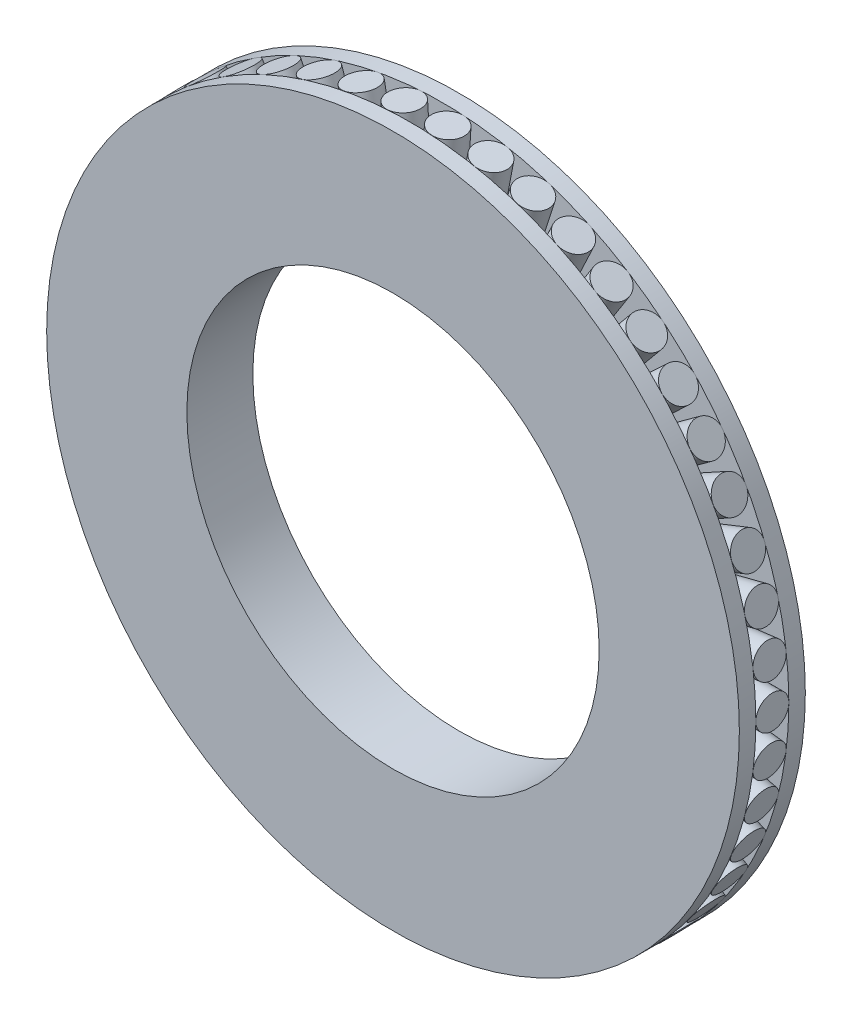
from build123d import *

# Parameters (mm, degrees)
SKETCH_1_R               = 21
SKETCH_1_R_2             = 12.5
EXTRUDE_1_DEPTH          = 4
CUT_EXTRUDE_1_DEPTH      = 1
CUT_EXTRUDE_1_DEPTH_BACK = 1
SKETCH_2_R               = 21
SKETCH_2_R_2             = 15
EXTRUDE_2_DEPTH          = 4
EXTRUDE_2_DEPTH_BACK     = 1
SKETCH_3_R               = 1
PATTERN_CIRCULAR_1_COUNT = 50


with BuildPart() as part:
    # 草图1 → 凸台-拉伸1 (new body)
    with BuildSketch(Plane.XY):
        Circle(SKETCH_1_R)
        Circle(SKETCH_1_R_2, mode=Mode.SUBTRACT)
    extrude(amount=EXTRUDE_1_DEPTH)

    # 草图2 → 切除-拉伸1 (cut, two sides: drawn at the far end of the back side and taken through both)
    with BuildSketch(Plane(origin=(0, 0, 2), x_dir=(-1, 0, 0), z_dir=(0, 0, -1)).offset(-CUT_EXTRUDE_1_DEPTH_BACK)):
        Circle(SKETCH_2_R)
        Circle(SKETCH_2_R_2, mode=Mode.SUBTRACT)
    extrude(amount=CUT_EXTRUDE_1_DEPTH + CUT_EXTRUDE_1_DEPTH_BACK, mode=Mode.SUBTRACT)


with BuildPart() as body_2:
    # 草图3 → 凸台-拉伸2 (new, two sides: drawn at the far end of the back side and taken through both)
    with BuildSketch(Plane(origin=(17, 0, 0), x_dir=(0, 0, -1), z_dir=(1, 0, 0)).offset(-EXTRUDE_2_DEPTH_BACK)):
        with Locations((-2, 0)):
            Circle(SKETCH_3_R)
    extrude(amount=EXTRUDE_2_DEPTH + EXTRUDE_2_DEPTH_BACK)


with BuildPart() as pattern_circular_1_1:
    # 阵列(圆周)1: pattern copy
    add(body_2.part.rotate(Axis((0, 0, 4), (0, 0, -1)), 1 * 360 / PATTERN_CIRCULAR_1_COUNT))


with BuildPart() as pattern_circular_1_2:
    # 阵列(圆周)1: pattern copy
    add(body_2.part.rotate(Axis((0, 0, 4), (0, 0, -1)), 2 * 360 / PATTERN_CIRCULAR_1_COUNT))


with BuildPart() as pattern_circular_1_3:
    # 阵列(圆周)1: pattern copy
    add(body_2.part.rotate(Axis((0, 0, 4), (0, 0, -1)), 3 * 360 / PATTERN_CIRCULAR_1_COUNT))


with BuildPart() as pattern_circular_1_4:
    # 阵列(圆周)1: pattern copy
    add(body_2.part.rotate(Axis((0, 0, 4), (0, 0, -1)), 4 * 360 / PATTERN_CIRCULAR_1_COUNT))


with BuildPart() as pattern_circular_1_5:
    # 阵列(圆周)1: pattern copy
    add(body_2.part.rotate(Axis((0, 0, 4), (0, 0, -1)), 5 * 360 / PATTERN_CIRCULAR_1_COUNT))


with BuildPart() as pattern_circular_1_6:
    # 阵列(圆周)1: pattern copy
    add(body_2.part.rotate(Axis((0, 0, 4), (0, 0, -1)), 6 * 360 / PATTERN_CIRCULAR_1_COUNT))


with BuildPart() as pattern_circular_1_7:
    # 阵列(圆周)1: pattern copy
    add(body_2.part.rotate(Axis((0, 0, 4), (0, 0, -1)), 7 * 360 / PATTERN_CIRCULAR_1_COUNT))


with BuildPart() as pattern_circular_1_8:
    # 阵列(圆周)1: pattern copy
    add(body_2.part.rotate(Axis((0, 0, 4), (0, 0, -1)), 8 * 360 / PATTERN_CIRCULAR_1_COUNT))


with BuildPart() as pattern_circular_1_9:
    # 阵列(圆周)1: pattern copy
    add(body_2.part.rotate(Axis((0, 0, 4), (0, 0, -1)), 9 * 360 / PATTERN_CIRCULAR_1_COUNT))


with BuildPart() as pattern_circular_1_10:
    # 阵列(圆周)1: pattern copy
    add(body_2.part.rotate(Axis((0, 0, 4), (0, 0, -1)), 10 * 360 / PATTERN_CIRCULAR_1_COUNT))


with BuildPart() as pattern_circular_1_11:
    # 阵列(圆周)1: pattern copy
    add(body_2.part.rotate(Axis((0, 0, 4), (0, 0, -1)), 11 * 360 / PATTERN_CIRCULAR_1_COUNT))


with BuildPart() as pattern_circular_1_12:
    # 阵列(圆周)1: pattern copy
    add(body_2.part.rotate(Axis((0, 0, 4), (0, 0, -1)), 12 * 360 / PATTERN_CIRCULAR_1_COUNT))


with BuildPart() as pattern_circular_1_13:
    # 阵列(圆周)1: pattern copy
    add(body_2.part.rotate(Axis((0, 0, 4), (0, 0, -1)), 13 * 360 / PATTERN_CIRCULAR_1_COUNT))


with BuildPart() as pattern_circular_1_14:
    # 阵列(圆周)1: pattern copy
    add(body_2.part.rotate(Axis((0, 0, 4), (0, 0, -1)), 14 * 360 / PATTERN_CIRCULAR_1_COUNT))


with BuildPart() as pattern_circular_1_15:
    # 阵列(圆周)1: pattern copy
    add(body_2.part.rotate(Axis((0, 0, 4), (0, 0, -1)), 15 * 360 / PATTERN_CIRCULAR_1_COUNT))


with BuildPart() as pattern_circular_1_16:
    # 阵列(圆周)1: pattern copy
    add(body_2.part.rotate(Axis((0, 0, 4), (0, 0, -1)), 16 * 360 / PATTERN_CIRCULAR_1_COUNT))


with BuildPart() as pattern_circular_1_17:
    # 阵列(圆周)1: pattern copy
    add(body_2.part.rotate(Axis((0, 0, 4), (0, 0, -1)), 17 * 360 / PATTERN_CIRCULAR_1_COUNT))


with BuildPart() as pattern_circular_1_18:
    # 阵列(圆周)1: pattern copy
    add(body_2.part.rotate(Axis((0, 0, 4), (0, 0, -1)), 18 * 360 / PATTERN_CIRCULAR_1_COUNT))


with BuildPart() as pattern_circular_1_19:
    # 阵列(圆周)1: pattern copy
    add(body_2.part.rotate(Axis((0, 0, 4), (0, 0, -1)), 19 * 360 / PATTERN_CIRCULAR_1_COUNT))


with BuildPart() as pattern_circular_1_20:
    # 阵列(圆周)1: pattern copy
    add(body_2.part.rotate(Axis((0, 0, 4), (0, 0, -1)), 20 * 360 / PATTERN_CIRCULAR_1_COUNT))


with BuildPart() as pattern_circular_1_21:
    # 阵列(圆周)1: pattern copy
    add(body_2.part.rotate(Axis((0, 0, 4), (0, 0, -1)), 21 * 360 / PATTERN_CIRCULAR_1_COUNT))


with BuildPart() as pattern_circular_1_22:
    # 阵列(圆周)1: pattern copy
    add(body_2.part.rotate(Axis((0, 0, 4), (0, 0, -1)), 22 * 360 / PATTERN_CIRCULAR_1_COUNT))


with BuildPart() as pattern_circular_1_23:
    # 阵列(圆周)1: pattern copy
    add(body_2.part.rotate(Axis((0, 0, 4), (0, 0, -1)), 23 * 360 / PATTERN_CIRCULAR_1_COUNT))


with BuildPart() as pattern_circular_1_24:
    # 阵列(圆周)1: pattern copy
    add(body_2.part.rotate(Axis((0, 0, 4), (0, 0, -1)), 24 * 360 / PATTERN_CIRCULAR_1_COUNT))


with BuildPart() as pattern_circular_1_25:
    # 阵列(圆周)1: pattern copy
    add(body_2.part.rotate(Axis((0, 0, 4), (0, 0, -1)), 25 * 360 / PATTERN_CIRCULAR_1_COUNT))


with BuildPart() as pattern_circular_1_26:
    # 阵列(圆周)1: pattern copy
    add(body_2.part.rotate(Axis((0, 0, 4), (0, 0, -1)), 26 * 360 / PATTERN_CIRCULAR_1_COUNT))


with BuildPart() as pattern_circular_1_27:
    # 阵列(圆周)1: pattern copy
    add(body_2.part.rotate(Axis((0, 0, 4), (0, 0, -1)), 27 * 360 / PATTERN_CIRCULAR_1_COUNT))


with BuildPart() as pattern_circular_1_28:
    # 阵列(圆周)1: pattern copy
    add(body_2.part.rotate(Axis((0, 0, 4), (0, 0, -1)), 28 * 360 / PATTERN_CIRCULAR_1_COUNT))


with BuildPart() as pattern_circular_1_29:
    # 阵列(圆周)1: pattern copy
    add(body_2.part.rotate(Axis((0, 0, 4), (0, 0, -1)), 29 * 360 / PATTERN_CIRCULAR_1_COUNT))


with BuildPart() as pattern_circular_1_30:
    # 阵列(圆周)1: pattern copy
    add(body_2.part.rotate(Axis((0, 0, 4), (0, 0, -1)), 30 * 360 / PATTERN_CIRCULAR_1_COUNT))


with BuildPart() as pattern_circular_1_31:
    # 阵列(圆周)1: pattern copy
    add(body_2.part.rotate(Axis((0, 0, 4), (0, 0, -1)), 31 * 360 / PATTERN_CIRCULAR_1_COUNT))


with BuildPart() as pattern_circular_1_32:
    # 阵列(圆周)1: pattern copy
    add(body_2.part.rotate(Axis((0, 0, 4), (0, 0, -1)), 32 * 360 / PATTERN_CIRCULAR_1_COUNT))


with BuildPart() as pattern_circular_1_33:
    # 阵列(圆周)1: pattern copy
    add(body_2.part.rotate(Axis((0, 0, 4), (0, 0, -1)), 33 * 360 / PATTERN_CIRCULAR_1_COUNT))


with BuildPart() as pattern_circular_1_34:
    # 阵列(圆周)1: pattern copy
    add(body_2.part.rotate(Axis((0, 0, 4), (0, 0, -1)), 34 * 360 / PATTERN_CIRCULAR_1_COUNT))


with BuildPart() as pattern_circular_1_35:
    # 阵列(圆周)1: pattern copy
    add(body_2.part.rotate(Axis((0, 0, 4), (0, 0, -1)), 35 * 360 / PATTERN_CIRCULAR_1_COUNT))


with BuildPart() as pattern_circular_1_36:
    # 阵列(圆周)1: pattern copy
    add(body_2.part.rotate(Axis((0, 0, 4), (0, 0, -1)), 36 * 360 / PATTERN_CIRCULAR_1_COUNT))


with BuildPart() as pattern_circular_1_37:
    # 阵列(圆周)1: pattern copy
    add(body_2.part.rotate(Axis((0, 0, 4), (0, 0, -1)), 37 * 360 / PATTERN_CIRCULAR_1_COUNT))


with BuildPart() as pattern_circular_1_38:
    # 阵列(圆周)1: pattern copy
    add(body_2.part.rotate(Axis((0, 0, 4), (0, 0, -1)), 38 * 360 / PATTERN_CIRCULAR_1_COUNT))


with BuildPart() as pattern_circular_1_39:
    # 阵列(圆周)1: pattern copy
    add(body_2.part.rotate(Axis((0, 0, 4), (0, 0, -1)), 39 * 360 / PATTERN_CIRCULAR_1_COUNT))


with BuildPart() as pattern_circular_1_40:
    # 阵列(圆周)1: pattern copy
    add(body_2.part.rotate(Axis((0, 0, 4), (0, 0, -1)), 40 * 360 / PATTERN_CIRCULAR_1_COUNT))


with BuildPart() as pattern_circular_1_41:
    # 阵列(圆周)1: pattern copy
    add(body_2.part.rotate(Axis((0, 0, 4), (0, 0, -1)), 41 * 360 / PATTERN_CIRCULAR_1_COUNT))


with BuildPart() as pattern_circular_1_42:
    # 阵列(圆周)1: pattern copy
    add(body_2.part.rotate(Axis((0, 0, 4), (0, 0, -1)), 42 * 360 / PATTERN_CIRCULAR_1_COUNT))


with BuildPart() as pattern_circular_1_43:
    # 阵列(圆周)1: pattern copy
    add(body_2.part.rotate(Axis((0, 0, 4), (0, 0, -1)), 43 * 360 / PATTERN_CIRCULAR_1_COUNT))


with BuildPart() as pattern_circular_1_44:
    # 阵列(圆周)1: pattern copy
    add(body_2.part.rotate(Axis((0, 0, 4), (0, 0, -1)), 44 * 360 / PATTERN_CIRCULAR_1_COUNT))


with BuildPart() as pattern_circular_1_45:
    # 阵列(圆周)1: pattern copy
    add(body_2.part.rotate(Axis((0, 0, 4), (0, 0, -1)), 45 * 360 / PATTERN_CIRCULAR_1_COUNT))


with BuildPart() as pattern_circular_1_46:
    # 阵列(圆周)1: pattern copy
    add(body_2.part.rotate(Axis((0, 0, 4), (0, 0, -1)), 46 * 360 / PATTERN_CIRCULAR_1_COUNT))


with BuildPart() as pattern_circular_1_47:
    # 阵列(圆周)1: pattern copy
    add(body_2.part.rotate(Axis((0, 0, 4), (0, 0, -1)), 47 * 360 / PATTERN_CIRCULAR_1_COUNT))


with BuildPart() as pattern_circular_1_48:
    # 阵列(圆周)1: pattern copy
    add(body_2.part.rotate(Axis((0, 0, 4), (0, 0, -1)), 48 * 360 / PATTERN_CIRCULAR_1_COUNT))


with BuildPart() as pattern_circular_1_49:
    # 阵列(圆周)1: pattern copy
    add(body_2.part.rotate(Axis((0, 0, 4), (0, 0, -1)), 49 * 360 / PATTERN_CIRCULAR_1_COUNT))


solid = Compound([part.part, body_2.part, pattern_circular_1_1.part, pattern_circular_1_2.part, pattern_circular_1_3.part, pattern_circular_1_4.part, pattern_circular_1_5.part, pattern_circular_1_6.part, pattern_circular_1_7.part, pattern_circular_1_8.part, pattern_circular_1_9.part, pattern_circular_1_10.part, pattern_circular_1_11.part, pattern_circular_1_12.part, pattern_circular_1_13.part, pattern_circular_1_14.part, pattern_circular_1_15.part, pattern_circular_1_16.part, pattern_circular_1_17.part, pattern_circular_1_18.part, pattern_circular_1_19.part, pattern_circular_1_20.part, pattern_circular_1_21.part, pattern_circular_1_22.part, pattern_circular_1_23.part, pattern_circular_1_24.part, pattern_circular_1_25.part, pattern_circular_1_26.part, pattern_circular_1_27.part, pattern_circular_1_28.part, pattern_circular_1_29.part, pattern_circular_1_30.part, pattern_circular_1_31.part, pattern_circular_1_32.part, pattern_circular_1_33.part, pattern_circular_1_34.part, pattern_circular_1_35.part, pattern_circular_1_36.part, pattern_circular_1_37.part, pattern_circular_1_38.part, pattern_circular_1_39.part, pattern_circular_1_40.part, pattern_circular_1_41.part, pattern_circular_1_42.part, pattern_circular_1_43.part, pattern_circular_1_44.part, pattern_circular_1_45.part, pattern_circular_1_46.part, pattern_circular_1_47.part, pattern_circular_1_48.part, pattern_circular_1_49.part])
